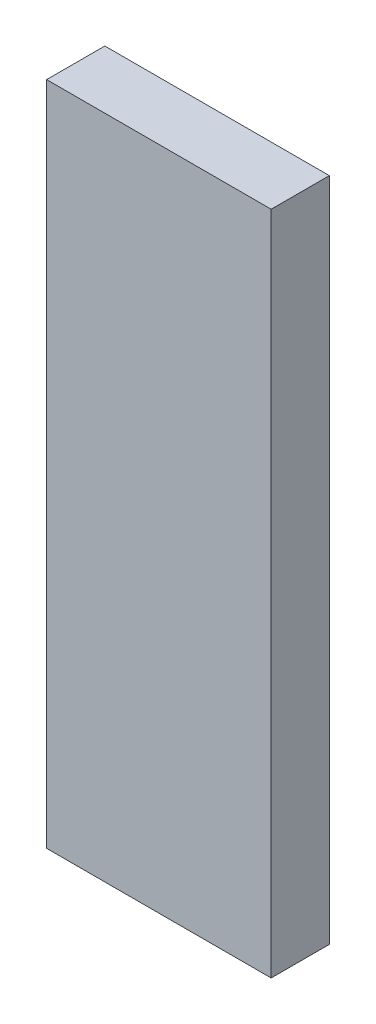
from build123d import *

# Parameters (mm, degrees)
SKETCH1_W           = 49
SKETCH1_H           = 12.7
BOSS_EXTRUDE1_DEPTH = 145.3


with BuildPart() as part:
    # Sketch1 → Boss-Extrude1 (new body)
    with BuildSketch(Plane(origin=(0, 0, 0), x_dir=(1, 0, 0), z_dir=(0, 1, 0))):
        Rectangle(SKETCH1_W, SKETCH1_H)
    extrude(amount=BOSS_EXTRUDE1_DEPTH)


solid = part.part
